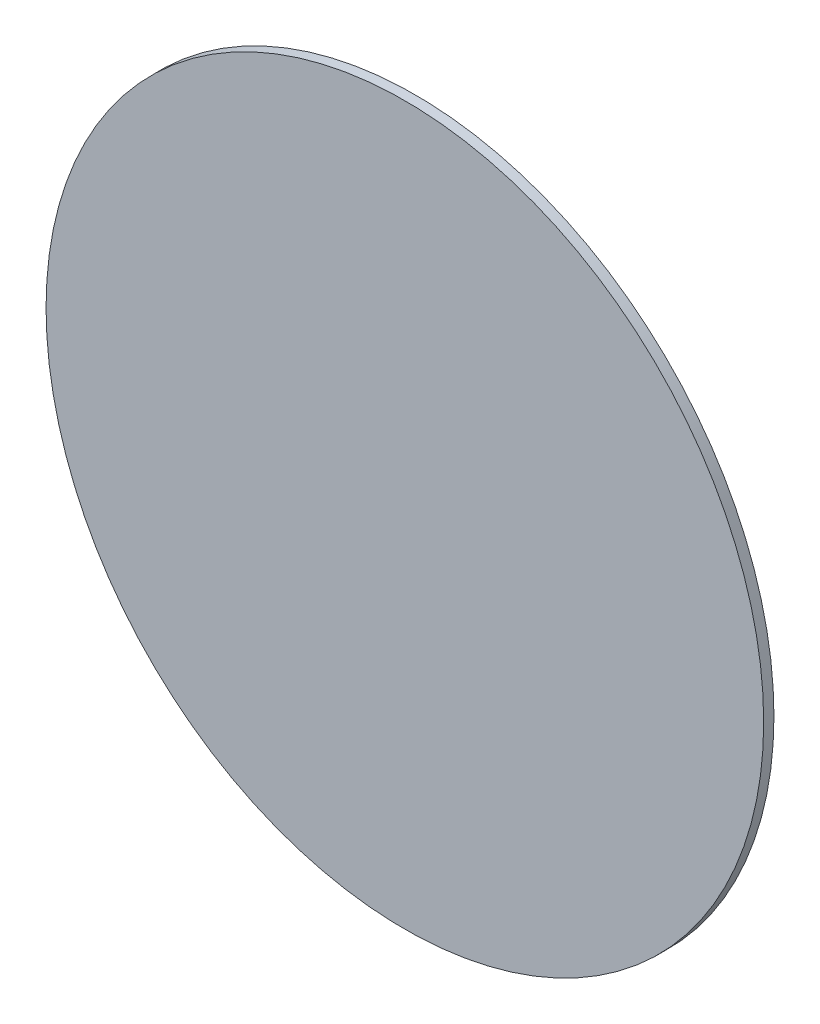
from build123d import *

# Parameters (mm, degrees)
ESQUISSE1_R        = 175
BOSS_EXTRU_1_DEPTH = 5


with BuildPart() as part:
    # Esquisse1 → Boss.-Extru.1 (new body)
    with BuildSketch(Plane.XY):
        Circle(ESQUISSE1_R)
    extrude(amount=BOSS_EXTRU_1_DEPTH)


solid = part.part
